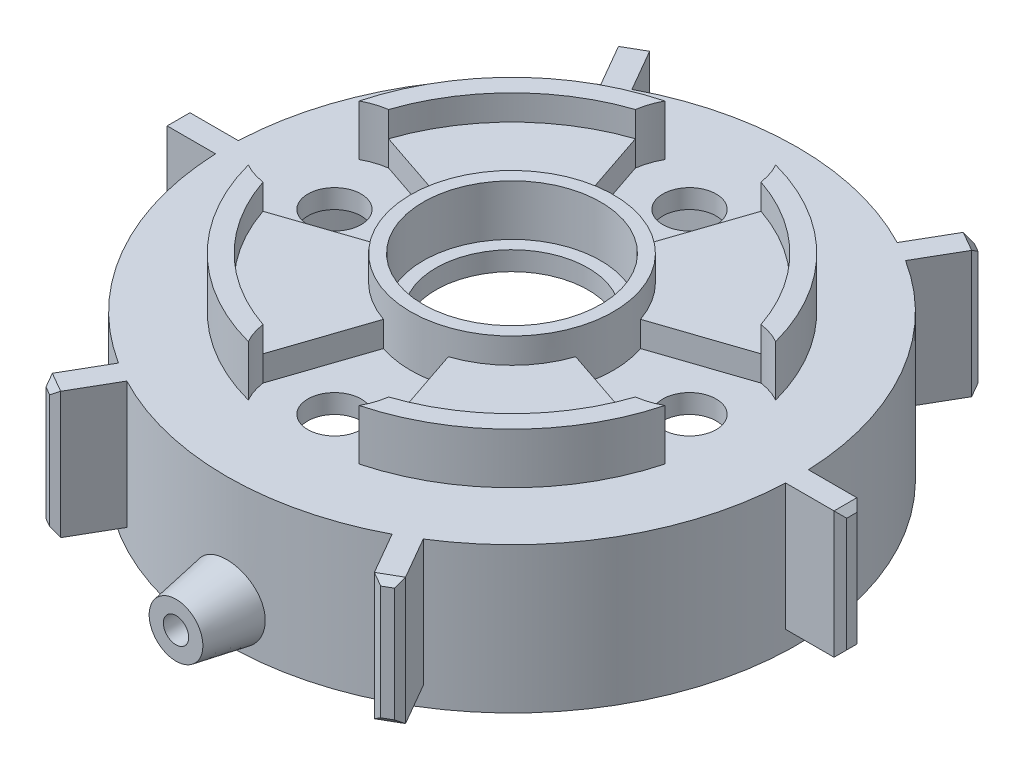
from build123d import *

# Parameters (mm, degrees)
SKETCH_2_R          = 22.5
SKETCH_2_R_2        = 2.0999999999999956
SKETCH_2_R_3        = 2.1
SKETCH_2_R_4        = 2.0999999999999974
SKETCH_2_R_5        = 6
EXTRUDE_1_DEPTH     = 1.5
EXTRUDE_START       = 10
SKETCH_4_R          = 22.500000000000004
SKETCH_4_R_2        = 21
EXTRUDE_2_DEPTH     = 10
EXTRUDE_3_DEPTH     = 10
SKETCH_6_R          = 8
SKETCH_6_R_2        = 7
EXTRUDE_4_DEPTH     = 4
EXTRUDE_5_DEPTH     = 2
CHAMFER_1_SIZE      = 0.5
EXTRUDE_START_2     = 21.5
SKETCH_9_R          = 3
EXTRUDE_6_DEPTH     = 5
EXTRUDE_6_TAPER     = 10.000000000000021
SKETCH_10_R         = 1
CUT_EXTRUDE_1_DEPTH = 5


with BuildPart() as part:
    # 草图2 → 凸台-拉伸1 (new body)
    with BuildSketch(Plane(origin=(0, 0, 0), x_dir=(1, 0, 0), z_dir=(0, 1, 0))):
        with Locations(Location((0, 0, 0), (0, 0, 270))):
            Circle(SKETCH_2_R)
        with Locations(Location((14, 0, 0), (0, 0, 270))):
            Circle(SKETCH_2_R_2, mode=Mode.SUBTRACT)
        with Locations(Location((0, 14, 0), (0, 0, 270))):
            Circle(SKETCH_2_R_3, mode=Mode.SUBTRACT)
        with Locations(Location((0, -14, 0), (0, 0, 90))):
            Circle(SKETCH_2_R_3, mode=Mode.SUBTRACT)
        with Locations(Location((-13.999999999999993, -3.43e-15, 0), (0, 0, 90))):
            Circle(SKETCH_2_R_4, mode=Mode.SUBTRACT)
        with Locations(Location((0, 0, 0), (0, 0, 270))):
            Circle(SKETCH_2_R_5, mode=Mode.SUBTRACT)
    extrude(amount=EXTRUDE_1_DEPTH)

    # 草图4 → 凸台-拉伸2 (add)
    with BuildSketch(Plane.XZ.offset(EXTRUDE_START)):
        with Locations(Location((0, 0, 0), (0, 0, 270))):
            Circle(SKETCH_4_R)
        with Locations(Location((0, 0, 0), (0, 0, 270))):
            Circle(SKETCH_4_R_2, mode=Mode.SUBTRACT)
    extrude(amount=-EXTRUDE_2_DEPTH)

    # 草图5 → 凸台-拉伸3 (add)
    with BuildSketch(Plane(origin=(0, 1.5, 0), x_dir=(1, 0, 0), z_dir=(0, 1, 0))):
        Polygon((26.8, 0.9), (26.8, -0.9), (21, -0.9000000000000008), (21, 0.9000000000000008), align=None)
        Polygon((12.620577136594008, -23.659480821422953), (9.720577136594008, -18.63653347947321), (11.279422863405998, -17.736533479473213), (14.179422863405998, -22.759480821422954), align=None)
        Polygon((-14.179422863405991, -22.759480821422965), (-11.279422863405994, -17.736533479473213), (-9.720577136594002, -18.636533479473215), (-12.620577136594001, -23.65948082142296), align=None)
        Polygon((-26.8, 0.8999999999999966), (-21, 0.8999999999999982), (-21, -0.9000000000000035), (-26.8, -0.9000000000000032), align=None)
        Polygon((-12.620577136594019, 23.65948082142295), (-9.720577136594015, 18.63653347947321), (-11.279422863406003, 17.73653347947321), (-14.179422863406007, 22.75948082142295), align=None)
        Polygon((14.179422863405977, 22.75948082142297), (11.279422863405983, 17.736533479473216), (9.72057713659399, 18.63653347947322), (12.620577136593988, 23.659480821422964), align=None)
    extrude(amount=-EXTRUDE_3_DEPTH)

    # 草图6 → 凸台-拉伸4 (add)
    # profile 1 of 5: a face of its own
    with BuildSketch(Plane(origin=(0, 1.5, 0), x_dir=(1, 0, 0), z_dir=(0, 1, 0))):
        with Locations(Location((0, 0, 0), (0, 0, 270))):
            Circle(SKETCH_6_R)
        with Locations(Location((0, 0, 0), (0, 0, 270))):
            Circle(SKETCH_6_R_2, mode=Mode.SUBTRACT)
    # profile 2 of 5: a face of its own
    with BuildSketch(Plane(origin=(0, 1.5, 0), x_dir=(1, 0, 0), z_dir=(0, 1, 0))):
        with BuildLine():
            ThreePointArc((16.42857142857143, 4.370588154508102), (12.02081528017131, 12.020815280171309), (4.370588154508102, 16.42857142857143))
            ThreePointArc((4.370588154508102, 16.42857142857143), (4.74213736554837, 15.584971042722852), (4.952508833914383, 14.6875))
            ThreePointArc((4.952508833914383, 14.6875), (10.960155108391488, 10.960155108391486), (14.687500000000002, 4.952508833914381))
            ThreePointArc((14.687500000000002, 4.952508833914381), (15.584971042722852, 4.742137365548372), (16.42857142857143, 4.370588154508102))
        make_face()
    # profile 3 of 5: a face of its own
    with BuildSketch(Plane(origin=(0, 1.5, 0), x_dir=(1, 0, 0), z_dir=(0, 1, 0))):
        with BuildLine():
            ThreePointArc((4.370588154508102, -16.42857142857143), (4.742137365548372, -15.584971042722852), (4.952508833914385, -14.6875))
            ThreePointArc((4.952508833914385, -14.6875), (10.960155108391488, -10.960155108391486), (14.687500000000002, -4.952508833914381))
            ThreePointArc((14.687500000000002, -4.952508833914381), (15.584971042722852, -4.742137365548368), (16.42857142857143, -4.370588154508102))
            ThreePointArc((16.42857142857143, -4.370588154508102), (12.02081528017131, -12.020815280171309), (4.370588154508102, -16.42857142857143))
        make_face()
    # profile 4 of 5: a face of its own
    with BuildSketch(Plane(origin=(0, 1.5, 0), x_dir=(1, 0, 0), z_dir=(0, 1, 0))):
        with BuildLine():
            ThreePointArc((-14.687500000000002, 4.952508833914374), (-15.584971042722852, 4.742137365548359), (-16.42857142857143, 4.370588154508093))
            ThreePointArc((-16.42857142857143, 4.370588154508093), (-12.020815280171314, 12.020815280171306), (-4.370588154508102, 16.42857142857143))
            ThreePointArc((-4.370588154508102, 16.42857142857143), (-4.742137365548372, 15.584971042722854), (-4.952508833914383, 14.6875))
            ThreePointArc((-4.952508833914383, 14.6875), (-10.960155108391486, 10.960155108391488), (-14.687500000000002, 4.952508833914374))
        make_face()
    # profile 5 of 5: a face of its own
    with BuildSketch(Plane(origin=(0, 1.5, 0), x_dir=(1, 0, 0), z_dir=(0, 1, 0))):
        with BuildLine():
            ThreePointArc((-4.952508833914385, -14.6875), (-4.742137365548372, -15.584971042722854), (-4.370588154508102, -16.42857142857143))
            ThreePointArc((-4.370588154508102, -16.42857142857143), (-12.020815280171309, -12.02081528017131), (-16.42857142857143, -4.370588154508101))
            ThreePointArc((-16.42857142857143, -4.370588154508101), (-15.584971042722854, -4.742137365548372), (-14.687500000000002, -4.952508833914382))
            ThreePointArc((-14.687500000000002, -4.952508833914382), (-10.960155108391486, -10.960155108391488), (-4.952508833914385, -14.6875))
        make_face()
    extrude(amount=EXTRUDE_4_DEPTH)

    # 草图7 → 凸台-拉伸5 (add)
    with BuildSketch(Plane(origin=(0, 1.5, 0), x_dir=(1, 0, 0), z_dir=(0, 1, 0))):
        with BuildLine():
            Line((14.687500000000002, -4.952508833914384), (7.580645161290323, -2.5561335916977446))
            ThreePointArc((7.580645161290323, -2.5561335916977446), (5.6568542494923815, -5.656854249492379), (2.5561335916977472, -7.580645161290323))
            Line((2.5561335916977472, -7.580645161290323), (4.952508833914385, -14.6875))
            ThreePointArc((4.952508833914385, -14.6875), (10.960155108391488, -10.960155108391486), (14.687500000000002, -4.952508833914384))
        make_face()
        with BuildLine():
            Line((-4.952508833914393, -14.6875), (-2.5561335916977583, -7.580645161290323))
            ThreePointArc((-2.5561335916977583, -7.580645161290323), (-5.656854249492388, -5.656854249492378), (-7.580645161290336, -2.5561335916977517))
            Line((-7.580645161290336, -2.5561335916977517), (-14.687500000000014, -4.952508833914387))
            ThreePointArc((-14.687500000000014, -4.952508833914387), (-10.960155108391493, -10.960155108391485), (-4.952508833914393, -14.6875))
        make_face()
        with BuildLine():
            Line((-14.687500000000014, 4.952508833914387), (-7.580645161290336, 2.5561335916977517))
            ThreePointArc((-7.580645161290336, 2.5561335916977517), (-5.656854249492388, 5.656854249492378), (-2.5561335916977583, 7.580645161290323))
            Line((-2.5561335916977583, 7.580645161290323), (-4.952508833914393, 14.6875))
            ThreePointArc((-4.952508833914393, 14.6875), (-10.960155108391493, 10.960155108391485), (-14.687500000000014, 4.952508833914387))
        make_face()
        with BuildLine():
            Line((4.952508833914385, 14.6875), (2.5561335916977472, 7.580645161290323))
            ThreePointArc((2.5561335916977472, 7.580645161290323), (5.6568542494923815, 5.656854249492379), (7.580645161290323, 2.5561335916977446))
            Line((7.580645161290323, 2.5561335916977446), (14.687500000000002, 4.952508833914381))
            ThreePointArc((14.687500000000002, 4.952508833914381), (10.960155108391488, 10.960155108391486), (4.952508833914385, 14.6875))
        make_face()
    extrude(amount=EXTRUDE_5_DEPTH)

    # 倒角1
    chamfer_1_edges = [part.edges().sort_by_distance(p)[0] for p in [
        (-26.8, -3.5, -0.8999999999999966),
        (-26.8, -8.5, 3.33e-15),
        (-26.8, -3.5, 0.9000000000000032),
        (-26.8, 1.5, 3.33e-15),
        (-12.620577136594019, -3.5, -23.65948082142295),
        (-13.400000000000013, -8.5, -23.20948082142295),
        (-14.179422863406007, -3.5, -22.75948082142295),
        (-13.400000000000013, 1.5, -23.20948082142295),
        (14.179422863405977, -3.5, -22.75948082142297),
        (13.399999999999983, -8.5, -23.209480821422964),
        (12.620577136593988, -3.5, -23.659480821422964),
        (13.399999999999983, 1.5, -23.209480821422964),
        (26.8, -3.5, 0.9),
        (26.8, -8.5, 0),
        (26.8, -3.5, -0.9),
        (26.8, 1.5, 0),
        (12.620577136594008, -3.5, 23.659480821422953),
        (13.400000000000002, -8.5, 23.209480821422954),
        (14.179422863405998, -3.5, 22.759480821422954),
        (13.400000000000002, 1.5, 23.209480821422954),
        (-14.179422863405991, -3.5, 22.759480821422965),
        (-13.399999999999995, -8.5, 23.209480821422964),
        (-12.620577136594001, -3.5, 23.65948082142296),
        (-13.399999999999995, 1.5, 23.209480821422964),
    ]]
    chamfer(chamfer_1_edges, length=CHAMFER_1_SIZE)

    # 草图9 → 凸台-拉伸6 (add)
    with BuildSketch(Plane.XY.offset(EXTRUDE_START_2)):
        with Locations((8.6e-16, -7)):
            Circle(SKETCH_9_R)
    extrude(amount=EXTRUDE_6_DEPTH, taper=EXTRUDE_6_TAPER)

    # 草图10 → 切除-拉伸1 (cut)
    with BuildSketch(Plane.XY.offset(26.5)):
        with Locations((8.6e-16, -7)):
            Circle(SKETCH_10_R)
    extrude(amount=-CUT_EXTRUDE_1_DEPTH, mode=Mode.SUBTRACT)


solid = part.part
